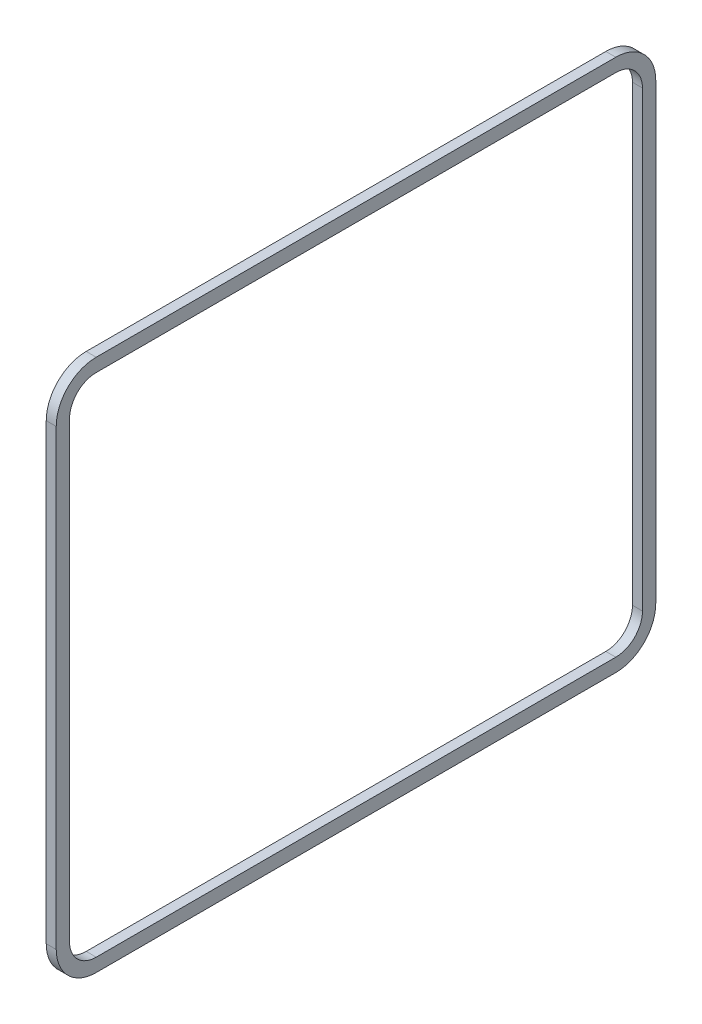
from build123d import *

# Parameters (mm, degrees)
BOSS_EXTRUDE1_DEPTH = 1.5


with BuildPart() as part:
    # Sketch1 → Boss-Extrude1 (new body)
    with BuildSketch(Plane(origin=(0, 0, 0), x_dir=(0, 0, -1), z_dir=(1, 0, 0))):
        with BuildLine():
            Line((39, -40), (-39, -40))
            ThreePointArc((-39, -40), (-43.242640687, -38.242640687), (-45, -34))
            Line((-45, -34), (-45, 34))
            ThreePointArc((-45, 34), (-43.242640687, 38.242640687), (-39, 40))
            Line((-39, 40), (39, 40))
            ThreePointArc((39, 40), (43.242640687, 38.242640687), (45, 34))
            Line((45, 34), (45, -34))
            ThreePointArc((45, -34), (43.242640687, -38.242640687), (39, -40))
        make_face()
        with BuildLine():
            Line((39, 38), (-39, 38))
            ThreePointArc((-39, 38), (-41.828427125, 36.828427125), (-43, 34))
            Line((-43, 34), (-43, -34))
            ThreePointArc((-43, -34), (-41.828427125, -36.828427125), (-39, -38))
            Line((-39, -38), (39, -38))
            ThreePointArc((39, -38), (41.828427125, -36.828427125), (43, -34))
            Line((43, -34), (43, 34))
            ThreePointArc((43, 34), (41.828427125, 36.828427125), (39, 38))
        make_face(mode=Mode.SUBTRACT)
    extrude(amount=BOSS_EXTRUDE1_DEPTH)


solid = part.part
